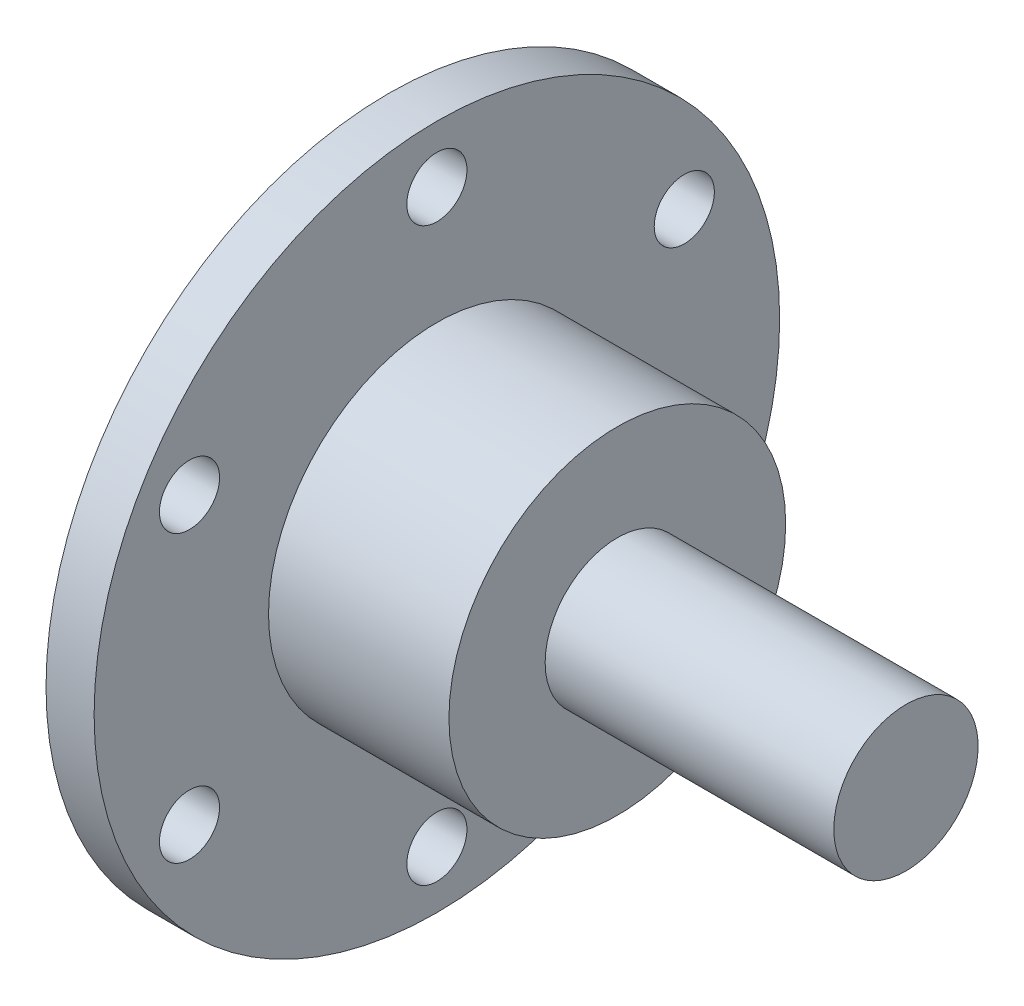
from build123d import *

# Parameters (mm, degrees)
CUT_EXTRUDE1_REACH = 60.936
SKETCH2_R          = 2.5


with BuildPart() as part:
    # Sketch1 → Revolve1 (revolve)
    with BuildSketch(Plane(origin=(0, 0, 0), x_dir=(1, 0, 0), z_dir=(0, 1, 0)), mode=Mode.PRIVATE) as revolve1_sk:
        Polygon((0, 0), (0, 28.5), (4, 28.5), (4, 14), (19, 14), (19, 6), (43, 6), (43, 0), align=None)
    revolve(revolve1_sk.sketch.rotate(Axis((-51.704391892, 0, 0), (1, 0, 0)), 180), axis=Axis((-51.704391892, 0, 0), (1, 0, 0)))

    # Sketch2 → Cut-Extrude1 (cut, up to next)
    with BuildSketch(Plane.ZY, mode=Mode.PRIVATE) as cut_extrude1_sk1:
        with Locations((0, 23.75)):
            Circle(SKETCH2_R)
    cut_extrude1_tool1 = extrude(cut_extrude1_sk1.sketch, amount=-CUT_EXTRUDE1_REACH, mode=Mode.PRIVATE) & part.part
    # Sketch2 → Cut-Extrude1 (cut, up to next)
    with BuildSketch(Plane.ZY, mode=Mode.PRIVATE) as cut_extrude1_sk2:
        with Locations((20.56810334, 11.875)):
            Circle(SKETCH2_R)
    cut_extrude1_tool2 = extrude(cut_extrude1_sk2.sketch, amount=-CUT_EXTRUDE1_REACH, mode=Mode.PRIVATE) & part.part
    # Sketch2 → Cut-Extrude1 (cut, up to next)
    with BuildSketch(Plane.ZY, mode=Mode.PRIVATE) as cut_extrude1_sk3:
        with Locations((20.56810334, -11.875)):
            Circle(SKETCH2_R)
    cut_extrude1_tool3 = extrude(cut_extrude1_sk3.sketch, amount=-CUT_EXTRUDE1_REACH, mode=Mode.PRIVATE) & part.part
    # Sketch2 → Cut-Extrude1 (cut, up to next)
    with BuildSketch(Plane.ZY, mode=Mode.PRIVATE) as cut_extrude1_sk4:
        with Locations((0, -23.75)):
            Circle(SKETCH2_R)
    cut_extrude1_tool4 = extrude(cut_extrude1_sk4.sketch, amount=-CUT_EXTRUDE1_REACH, mode=Mode.PRIVATE) & part.part
    # Sketch2 → Cut-Extrude1 (cut, up to next)
    with BuildSketch(Plane.ZY, mode=Mode.PRIVATE) as cut_extrude1_sk5:
        with Locations((-20.56810334, -11.875)):
            Circle(SKETCH2_R)
    cut_extrude1_tool5 = extrude(cut_extrude1_sk5.sketch, amount=-CUT_EXTRUDE1_REACH, mode=Mode.PRIVATE) & part.part
    # Sketch2 → Cut-Extrude1 (cut, up to next)
    with BuildSketch(Plane.ZY, mode=Mode.PRIVATE) as cut_extrude1_sk6:
        with Locations((-20.56810334, 11.875)):
            Circle(SKETCH2_R)
    cut_extrude1_tool6 = extrude(cut_extrude1_sk6.sketch, amount=-CUT_EXTRUDE1_REACH, mode=Mode.PRIVATE) & part.part
    add(cut_extrude1_tool1.solids().sort_by_distance((0, 23.75, 0))[0], mode=Mode.SUBTRACT)
    add(cut_extrude1_tool2.solids().sort_by_distance((0, 11.875, 20.568103))[0], mode=Mode.SUBTRACT)
    add(cut_extrude1_tool3.solids().sort_by_distance((0, -11.875, 20.568103))[0], mode=Mode.SUBTRACT)
    add(cut_extrude1_tool4.solids().sort_by_distance((0, -23.75, 0))[0], mode=Mode.SUBTRACT)
    add(cut_extrude1_tool5.solids().sort_by_distance((0, -11.875, -20.568103))[0], mode=Mode.SUBTRACT)
    add(cut_extrude1_tool6.solids().sort_by_distance((0, 11.875, -20.568103))[0], mode=Mode.SUBTRACT)


solid = part.part
